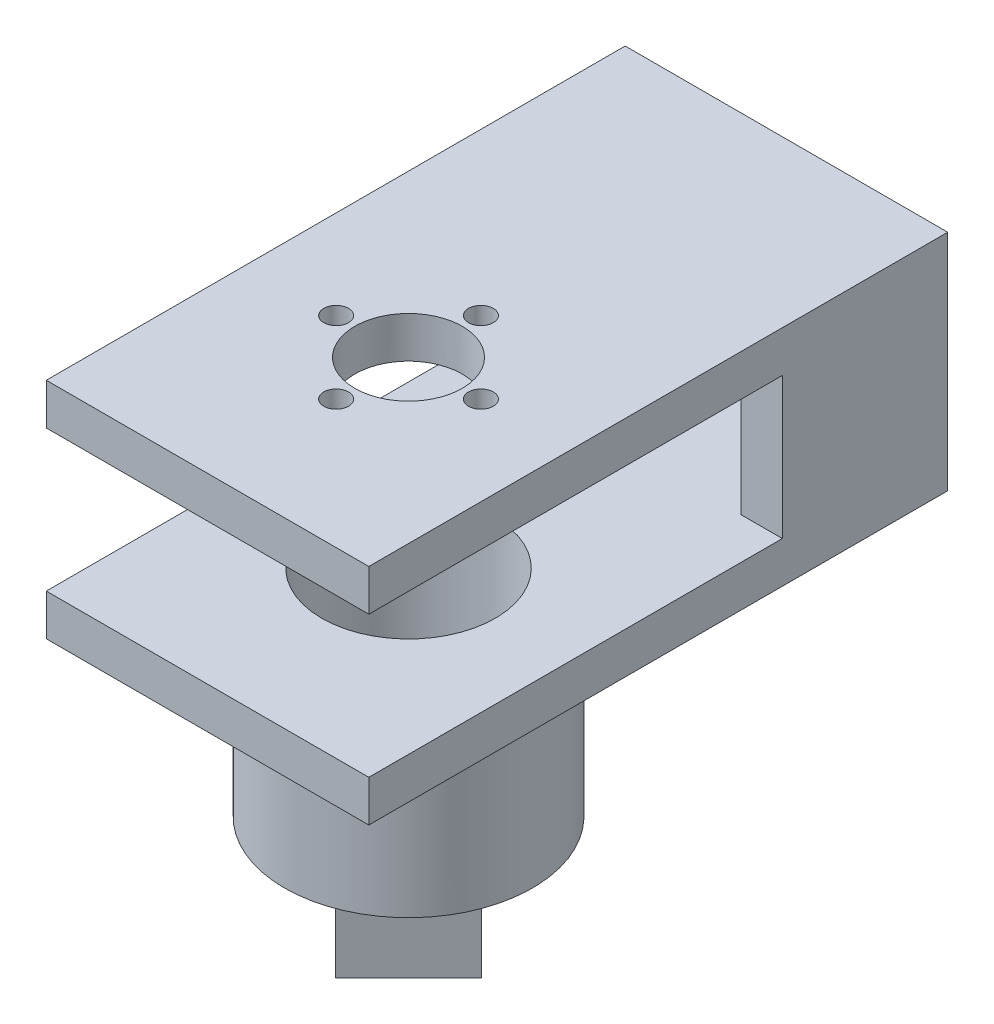
from build123d import *

# Parameters (mm, degrees)
SKETCH_1_W               = 78
SKETCH_1_H               = 54.155555556
SKETCH_1_W_2             = 58
SKETCH_1_H_2             = 34.155555556
EXTRUDE_1_DEPTH          = 40
SKETCH_2_W               = 78
SKETCH_2_H               = 10
EXTRUDE_1_2_DEPTH        = 100
EXTRUDE_2_DEPTH          = 5
SKETCH_4_R               = 21
CUT_EXTRUDE_1_DEPTH      = 162.782919637
EXTRUDE_3_DEPTH          = 100
CUT_EXTRUDE_2_REACH      = 166.793
SKETCH_6_R               = 13
SKETCH_8_R               = 3
CUT_EXTRUDE_3_DEPTH      = 35
PATTERN_CIRCULAR_1_COUNT = 4
SKETCH_9_R               = 30
SKETCH_9_R_2             = 21
EXTRUDE_4_DEPTH          = 22
SKETCH_10_R              = 30
SKETCH_10_R_2            = 3.5
EXTRUDE_5_DEPTH          = 20
EXTRUDE_6_DEPTH          = 25


with BuildPart() as part:
    # 草图1 → Extrude 1 (new body)
    with BuildSketch(Plane.XY):
        with Locations((29, -17.077777778)):
            Rectangle(SKETCH_1_W, SKETCH_1_H)
        with Locations((29, -17.077777778)):
            Rectangle(SKETCH_1_W_2, SKETCH_1_H_2, mode=Mode.SUBTRACT)
    extrude(amount=EXTRUDE_1_DEPTH)

    # 草图2 → Extrude 1 2 (add)
    with BuildSketch(Plane.XY.offset(40)):
        with Locations((29, -39.155555556)):
            Rectangle(SKETCH_2_W, SKETCH_2_H)
    extrude(amount=EXTRUDE_1_2_DEPTH)

    # 草图3 → 凸台-拉伸2 (add)
    with BuildSketch(Plane(origin=(0, 0, 0), x_dir=(-1, 0, 0), z_dir=(0, 0, -1))):
        Polygon((-58, -29.155555556), (-58, -34.155555556), (-53, -34.155555556), align=None)
        Polygon((0, -29.155555556), (0, -34.155555556), (-5, -34.155555556), align=None)
    extrude(amount=-EXTRUDE_2_DEPTH)

    # 草图4 → 切除-拉伸1 (cut, through all)
    with BuildSketch(Plane(origin=(0, -34.155555556, 0), x_dir=(1, 0, 0), z_dir=(0, 1, 0))):
        with Locations(Location((29, -91.398483043, 0), (0, 0, 270))):
            Circle(SKETCH_4_R)
    extrude(amount=-CUT_EXTRUDE_1_DEPTH, mode=Mode.SUBTRACT)

    # 草图5 → 凸台-拉伸3 (add)
    with BuildSketch(Plane.XY.offset(40)):
        Polygon((-10, 10), (-10, 0), (0, 0), (58, 0), (68, 0), (68, 10), align=None)
    extrude(amount=EXTRUDE_3_DEPTH)

    # 草图6 → 切除-拉伸2 (cut, up to next)
    with BuildSketch(Plane(origin=(0, 10, 0), x_dir=(1, 0, 0), z_dir=(0, 1, 0)), mode=Mode.PRIVATE) as cut_extrude_2_sk1:
        with Locations(Location((29, -91.398483043, 0), (0, 0, 270))):
            Circle(SKETCH_6_R)
    cut_extrude_2_tool1 = extrude(cut_extrude_2_sk1.sketch, amount=-CUT_EXTRUDE_2_REACH, mode=Mode.PRIVATE) & part.part
    add(cut_extrude_2_tool1.solids().sort_by_distance((29, 10, 91.398483))[0], mode=Mode.SUBTRACT)

    # 草图8 → 切除-拉伸3 (cut)
    with BuildSketch(Plane(origin=(0, 10, 0), x_dir=(1, 0, 0), z_dir=(0, 1, 0))):
        with Locations(Location((29, -73.898483043, 0), (0, 0, 270))):
            Circle(SKETCH_8_R)
    cut_extrude_3 = extrude(amount=-CUT_EXTRUDE_3_DEPTH, mode=Mode.SUBTRACT)

    # 阵列(圆周)1: 切除-拉伸3 ×4 about axis
    pattern_circular_1_axis = Axis((29, 0, 91.398483043), (0, 1, 0))
    for i in range(1, PATTERN_CIRCULAR_1_COUNT):
        add(cut_extrude_3.rotate(pattern_circular_1_axis, i * 360 / PATTERN_CIRCULAR_1_COUNT), mode=Mode.SUBTRACT)

    # 草图9 → 凸台-拉伸4 (add)
    with BuildSketch(Plane.XZ.offset(44.155555556)):
        with Locations(Location((29, 91.398483043, 0), (0, 0, 90))):
            Circle(SKETCH_9_R)
        with Locations(Location((29, 91.398483043, 0), (0, 0, 90))):
            Circle(SKETCH_9_R_2, mode=Mode.SUBTRACT)
    extrude(amount=EXTRUDE_4_DEPTH)

    # 草图10 → 凸台-拉伸5 (add)
    with BuildSketch(Plane.XZ.offset(66.155555556)):
        with Locations(Location((29, 91.398483043, 0), (0, 0, 90))):
            Circle(SKETCH_10_R)
        with Locations(Location((29, 91.398483043, 0), (0, 0, 270))):
            Circle(SKETCH_10_R_2, mode=Mode.SUBTRACT)
    extrude(amount=EXTRUDE_5_DEPTH)

    # 草图12 → 凸台-拉伸6 (add)
    with BuildSketch(Plane.XZ.offset(86.155555556)):
        Polygon((11.32233047, 91.398483043), (29, 109.076152573), (46.67766953, 91.398483043), (29, 73.720813513), align=None)
    extrude(amount=EXTRUDE_6_DEPTH)


solid = part.part
